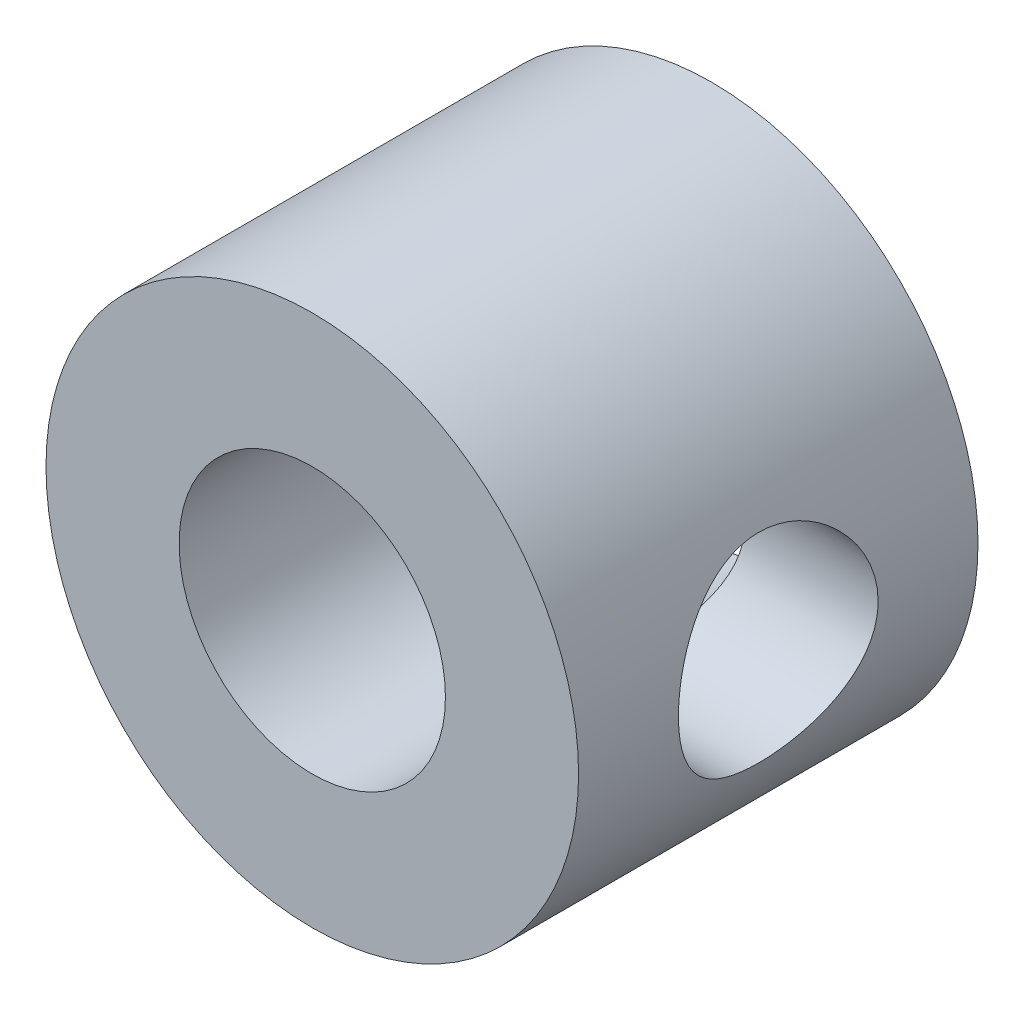
from build123d import *

# Parameters (mm, degrees)
SKETCH_1_R           = 4
SKETCH_1_R_2         = 2.025
EXTRUDE_6_DEPTH      = 6
MOVE_FACE_D4_BY      = 0.025
SKETCH_2_R           = 1.5
CUT_EXTRUDE_M3_DEPTH = 9.246211251


with BuildPart() as part:
    # 草图1 → 轴向尺寸_6 (new body)
    with BuildSketch(Plane.XY):
        Circle(SKETCH_1_R)
        Circle(SKETCH_1_R_2, mode=Mode.SUBTRACT)
    extrude(amount=EXTRUDE_6_DEPTH)

    # Move Face D4: a curved face moved outward by 0.025
    add(Solid.thicken(part.faces().sort_by_distance((-2.025, 0, 3))[0], MOVE_FACE_D4_BY))

    # 草图2 → 径向M3螺纹大径包络 (cut, through all)
    with BuildSketch(Plane(origin=(0, 0, 0), x_dir=(0, 0, -1), z_dir=(1, 0, 0))):
        with Locations(Location((-3, 0, 0), (0, 0, 180))):
            Circle(SKETCH_2_R)
    extrude(amount=CUT_EXTRUDE_M3_DEPTH, mode=Mode.SUBTRACT)


solid = part.part
